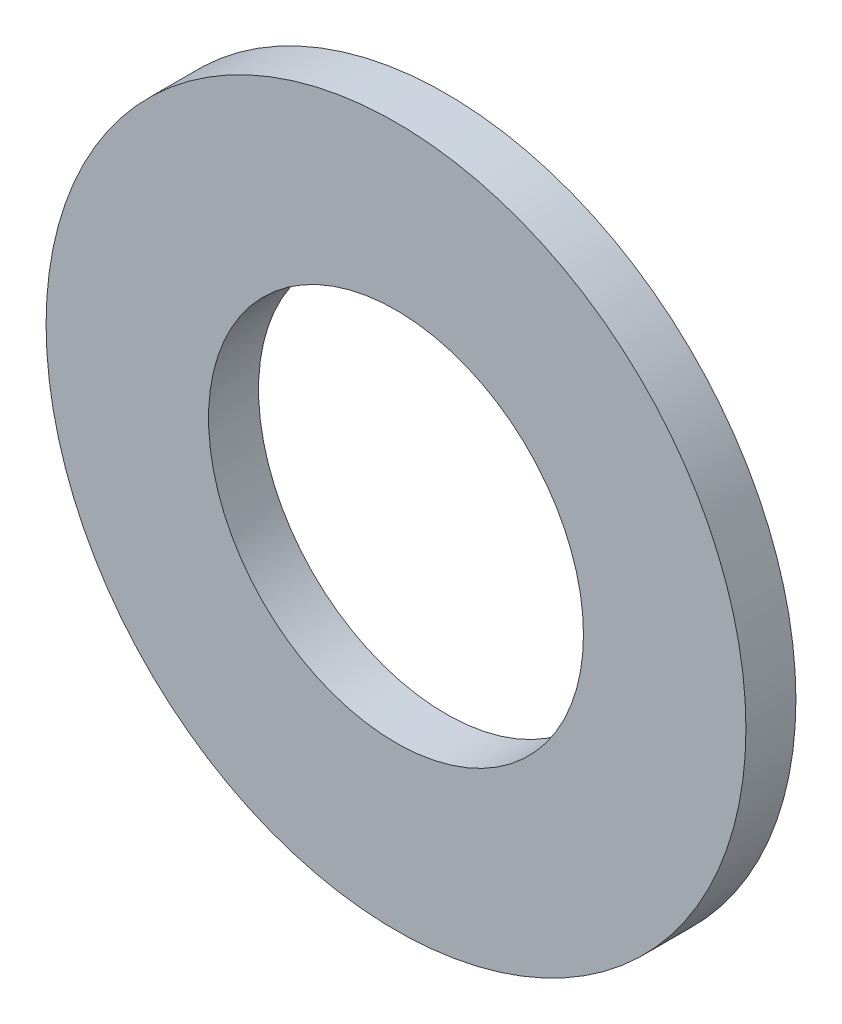
from build123d import *

# Parameters (mm, degrees)
CROQUIS1_W            = 3.175
CROQUIS1_H            = 22.225
CORTAR_EXTRUIR1_REACH = 33.591
CROQUIS2_R            = 11.906


with BuildPart() as part:
    # Croquis1 → Revolución1 (revolve)
    with BuildSketch(Plane(origin=(0, 0, 0), x_dir=(0, 0, -1), z_dir=(1, 0, 0)), mode=Mode.PRIVATE) as revoluci_n1_sk:
        with Locations((1.5875, 11.1125)):
            Rectangle(CROQUIS1_W, CROQUIS1_H)
    revolve(revoluci_n1_sk.sketch.rotate(Axis((0, 0, 0), (0, 0, -1)), 90), axis=Axis((0, 0, 0), (0, 0, -1)))

    # Croquis2 → Cortar-Extruir1 (cut, up to next)
    with BuildSketch(Plane.XY, mode=Mode.PRIVATE) as cortar_extruir1_sk1:
        Circle(CROQUIS2_R)
    cortar_extruir1_tool1 = extrude(cortar_extruir1_sk1.sketch, amount=-CORTAR_EXTRUIR1_REACH, mode=Mode.PRIVATE) & part.part
    add(cortar_extruir1_tool1.solids().sort_by_distance((0, 0, 0))[0], mode=Mode.SUBTRACT)


solid = part.part
